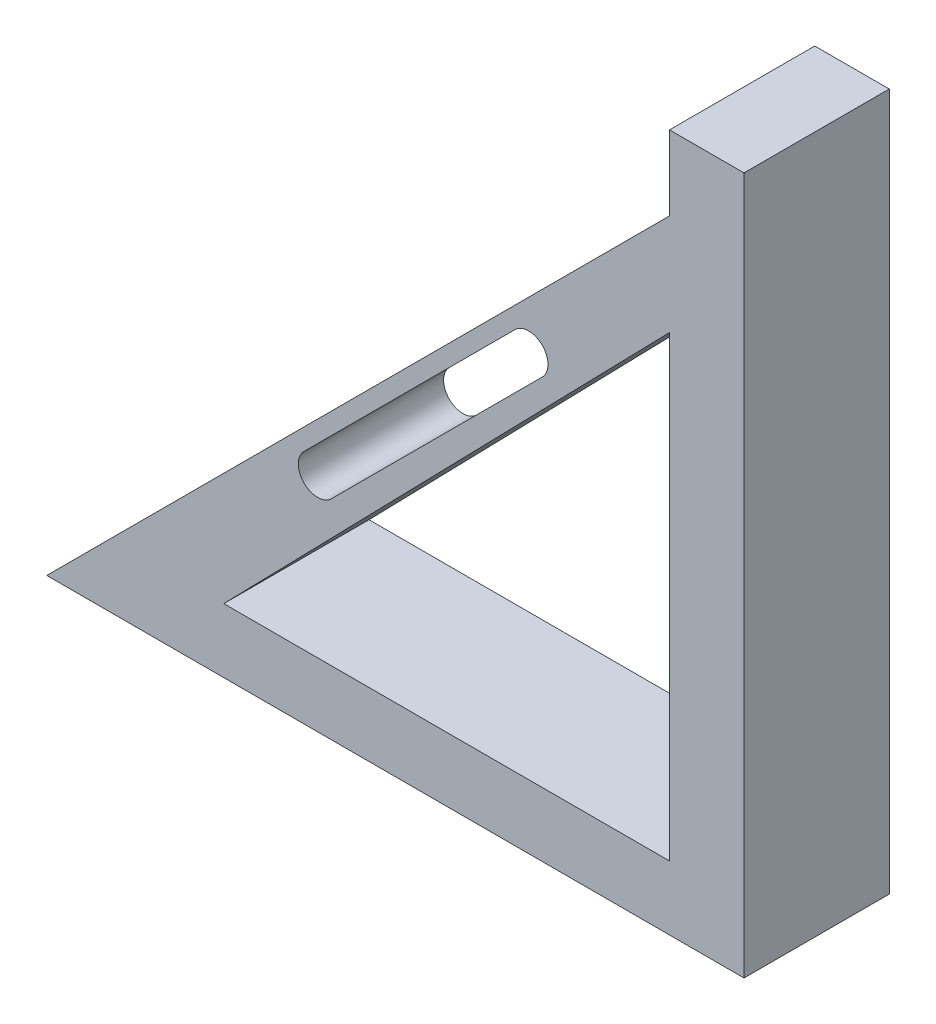
from build123d import *

# Parameters (mm, degrees)
BOSS_EXTRUDE1_DEPTH = 25
CUT_EXTRUDE1_DEPTH  = 25


with BuildPart() as part:
    # Sketch1 → Boss-Extrude1 (new body)
    with BuildSketch(Plane.XY):
        Polygon((47.177011042, 107.177011042), (-60, 0), (60, 0), (60, 120), (47.177011042, 120), align=None)
        Polygon((47.177011042, 89.789277975), (47.177011042, 11.03307526), (-29.533576018, 11.03307526), align=None, mode=Mode.SUBTRACT)
    extrude(amount=BOSS_EXTRUDE1_DEPTH)

    # Sketch2 → Cut-Extrude1 (cut)
    with BuildSketch(Plane.XY.offset(25)):
        with BuildLine():
            Line((25.294500052, 72.229110711), (-11.022426811, 35.912183847))
            ThreePointArc((-11.022426811, 35.912183847), (-15.729304171, 35.912183847), (-15.729304171, 40.619061207))
            Line((-15.729304171, 40.619061207), (20.587622692, 76.93598807))
            ThreePointArc((20.587622692, 76.93598807), (25.294500052, 76.93598807), (25.294500052, 72.229110711))
        make_face()
    extrude(amount=-CUT_EXTRUDE1_DEPTH, mode=Mode.SUBTRACT)


solid = part.part
